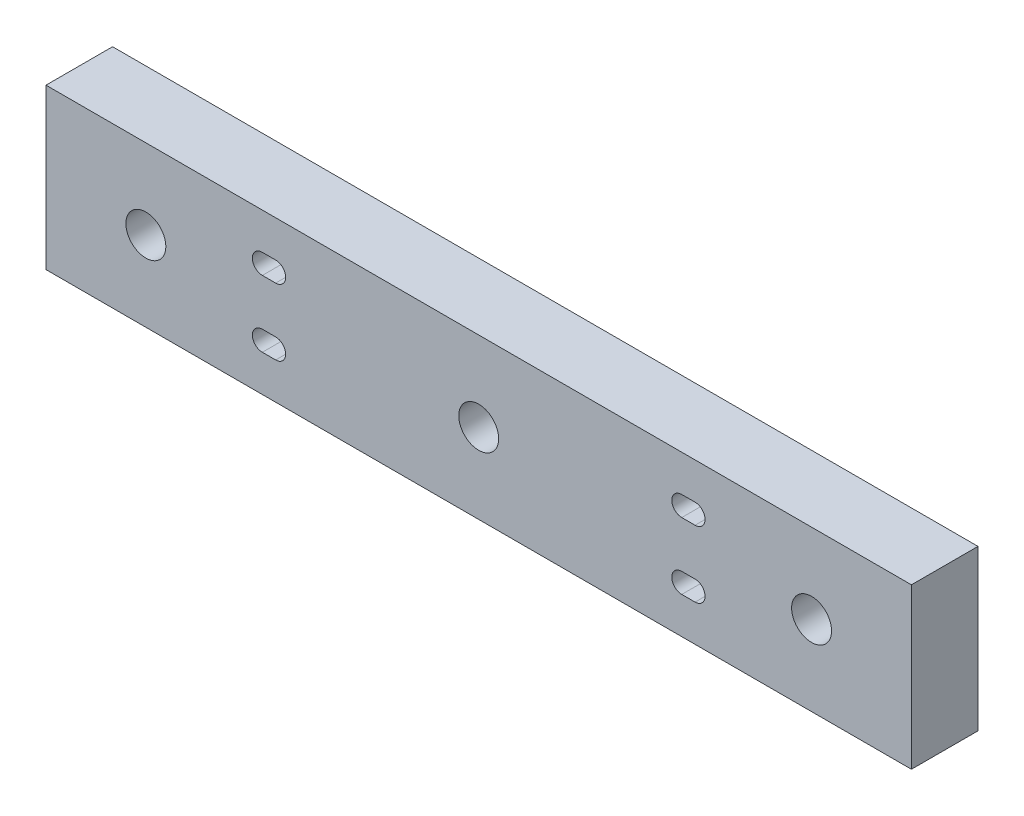
from build123d import *

# Parameters (mm, degrees)
SKETCH_1_W          = 130
SKETCH_1_H          = 24
SKETCH_1_R          = 3
EXTRUDE_1_DEPTH     = 10
SKETCH_2_R          = 4
CUT_EXTRUDE_1_DEPTH = 7


with BuildPart() as part:
    # 草图1 → 凸台-拉伸1 (new body)
    with BuildSketch(Plane.XY):
        Rectangle(SKETCH_1_W, SKETCH_1_H)
        with Locations((-50, 0)):
            Circle(SKETCH_1_R, mode=Mode.SUBTRACT)
        with Locations((50, 0)):
            Circle(SKETCH_1_R, mode=Mode.SUBTRACT)
        Circle(SKETCH_1_R, mode=Mode.SUBTRACT)
        with BuildLine():
            Line((32.5, 6.5), (30.5, 6.5))
            ThreePointArc((30.5, 6.5), (29, 5), (30.5, 3.5))
            Line((30.5, 3.5), (32.5, 3.5))
            ThreePointArc((32.5, 3.5), (34, 5), (32.5, 6.5))
        make_face(mode=Mode.SUBTRACT)
        with BuildLine():
            Line((32.5, -6.5), (30.5, -6.5))
            ThreePointArc((30.5, -6.5), (29, -5), (30.5, -3.5))
            Line((30.5, -3.5), (32.5, -3.5))
            ThreePointArc((32.5, -3.5), (34, -5), (32.5, -6.5))
        make_face(mode=Mode.SUBTRACT)
        with BuildLine():
            Line((-32.5, 6.5), (-30.5, 6.5))
            ThreePointArc((-30.5, 6.5), (-29, 5), (-30.5, 3.5))
            Line((-30.5, 3.5), (-32.5, 3.5))
            ThreePointArc((-32.5, 3.5), (-34, 5), (-32.5, 6.5))
        make_face(mode=Mode.SUBTRACT)
        with BuildLine():
            Line((-32.5, -6.5), (-30.5, -6.5))
            ThreePointArc((-30.5, -6.5), (-29, -5), (-30.5, -3.5))
            Line((-30.5, -3.5), (-32.5, -3.5))
            ThreePointArc((-32.5, -3.5), (-34, -5), (-32.5, -6.5))
        make_face(mode=Mode.SUBTRACT)
    extrude(amount=EXTRUDE_1_DEPTH)

    # 草图2 → 切除-拉伸1 (cut)
    with BuildSketch(Plane(origin=(0, 0, 0), x_dir=(-1, 0, 0), z_dir=(0, 0, -1))):
        with Locations((-31.5, 5)):
            Circle(SKETCH_2_R)
        with Locations((-31.5, -5)):
            Circle(SKETCH_2_R)
        with Locations(Location((31.5, -5, 0), (0, 0, 180))):
            Circle(SKETCH_2_R)
        with Locations(Location((31.5, 5, 0), (0, 0, 180))):
            Circle(SKETCH_2_R)
    extrude(amount=-CUT_EXTRUDE_1_DEPTH, mode=Mode.SUBTRACT)


solid = part.part
